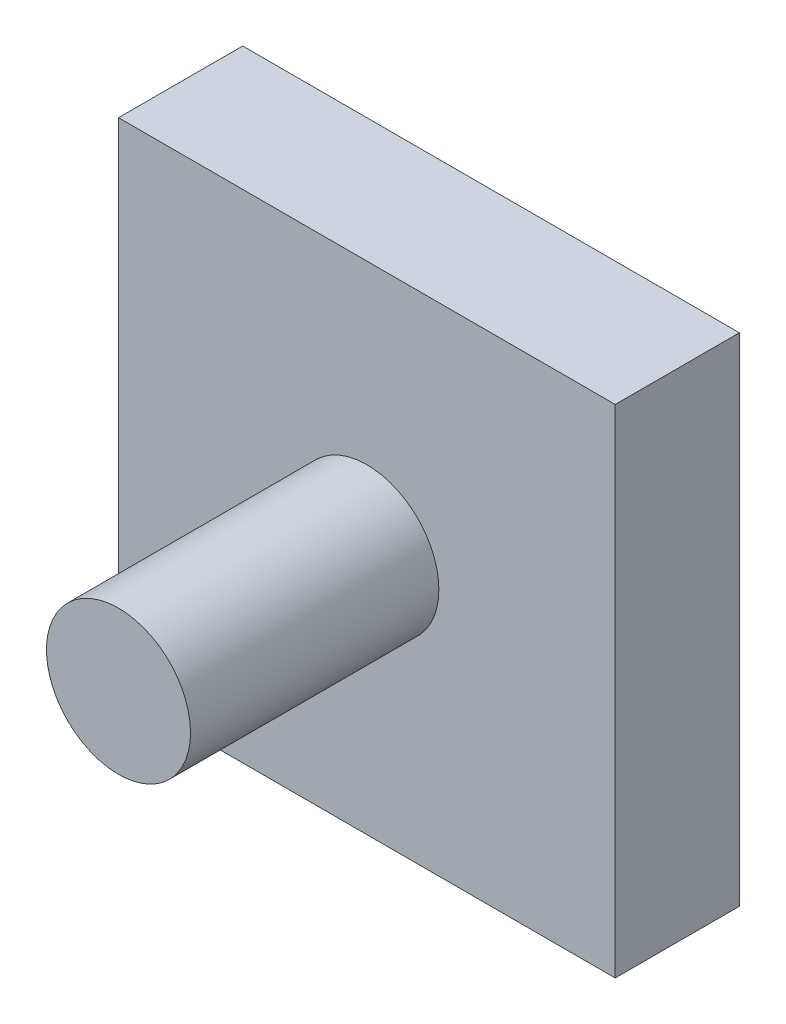
from build123d import *

# Parameters (mm, degrees)
ESQUISSE1_W        = 200
ESQUISSE1_H        = 200
BOSS_EXTRU_1_DEPTH = 50
ESQUISSE2_R        = 29
BOSS_EXTRU_2_DEPTH = 100


with BuildPart() as part:
    # Esquisse1 → Boss.-Extru.1 (new body)
    with BuildSketch(Plane.XY):
        Rectangle(ESQUISSE1_W, ESQUISSE1_H)
    extrude(amount=BOSS_EXTRU_1_DEPTH)

    # Esquisse2 → Boss.-Extru.2 (add)
    with BuildSketch(Plane.XY.offset(50)):
        Circle(ESQUISSE2_R)
    extrude(amount=BOSS_EXTRU_2_DEPTH)


solid = part.part
